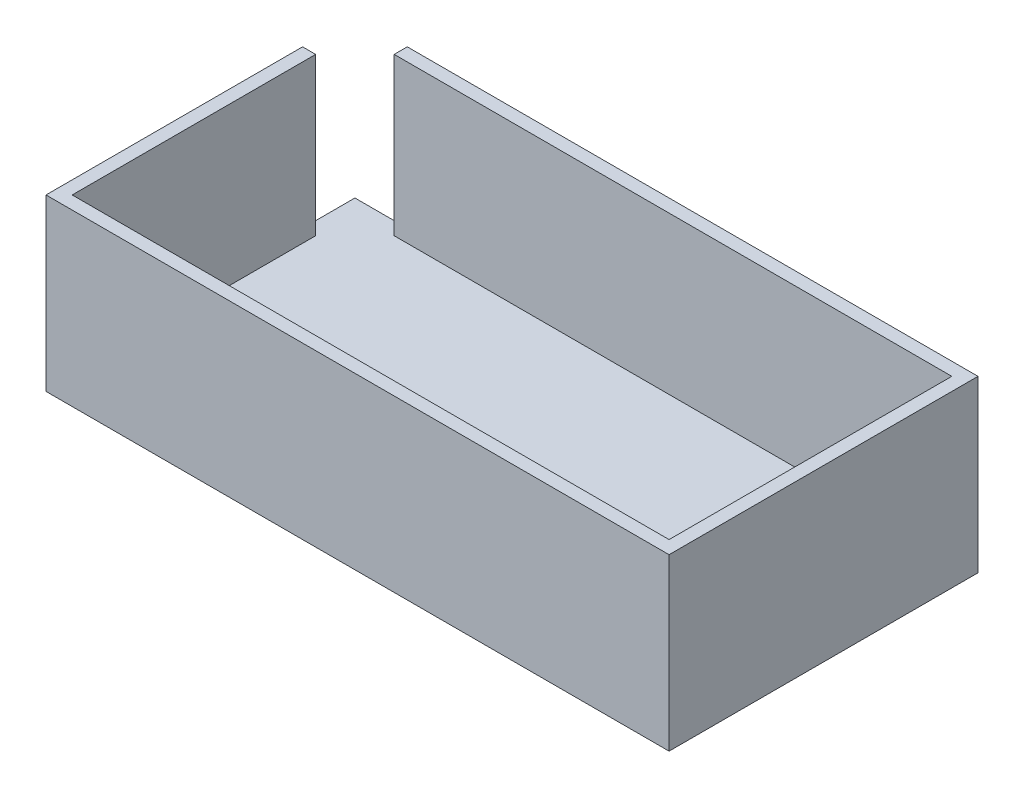
from build123d import *

# Parameters (mm, degrees)
SKETCH1_W           = 75.565
SKETCH1_H           = 37.465
SKETCH1_W_2         = 72.39
SKETCH1_H_2         = 34.29
BOSS_EXTRUDE1_DEPTH = 19.05
SKETCH2_W           = 75.565
SKETCH2_H           = 37.465
BOSS_EXTRUDE2_DEPTH = 1.5875
SKETCH3_W           = 6.35
SKETCH3_H           = 6.35
CUT_EXTRUDE1_DEPTH  = 19.05


with BuildPart() as part:
    # Sketch1 → Boss-Extrude1 (new body)
    with BuildSketch(Plane(origin=(0, 0, 0), x_dir=(1, 0, 0), z_dir=(0, 1, 0))):
        with Locations((36.195, 17.145)):
            Rectangle(SKETCH1_W, SKETCH1_H)
        with Locations((36.195, 17.145)):
            Rectangle(SKETCH1_W_2, SKETCH1_H_2, mode=Mode.SUBTRACT)
    extrude(amount=BOSS_EXTRUDE1_DEPTH)

    # Sketch2 → Boss-Extrude2 (add)
    with BuildSketch(Plane.XZ):
        with Locations((36.195, -17.145)):
            Rectangle(SKETCH2_W, SKETCH2_H)
    extrude(amount=BOSS_EXTRUDE2_DEPTH)

    # Sketch3 → Cut-Extrude1 (cut)
    with BuildSketch(Plane(origin=(0, 19.05, 0), x_dir=(1, 0, 0), z_dir=(0, 1, 0))):
        with Locations((1.5875, 32.7025)):
            Rectangle(SKETCH3_W, SKETCH3_H)
    extrude(amount=-CUT_EXTRUDE1_DEPTH, mode=Mode.SUBTRACT)


solid = part.part
